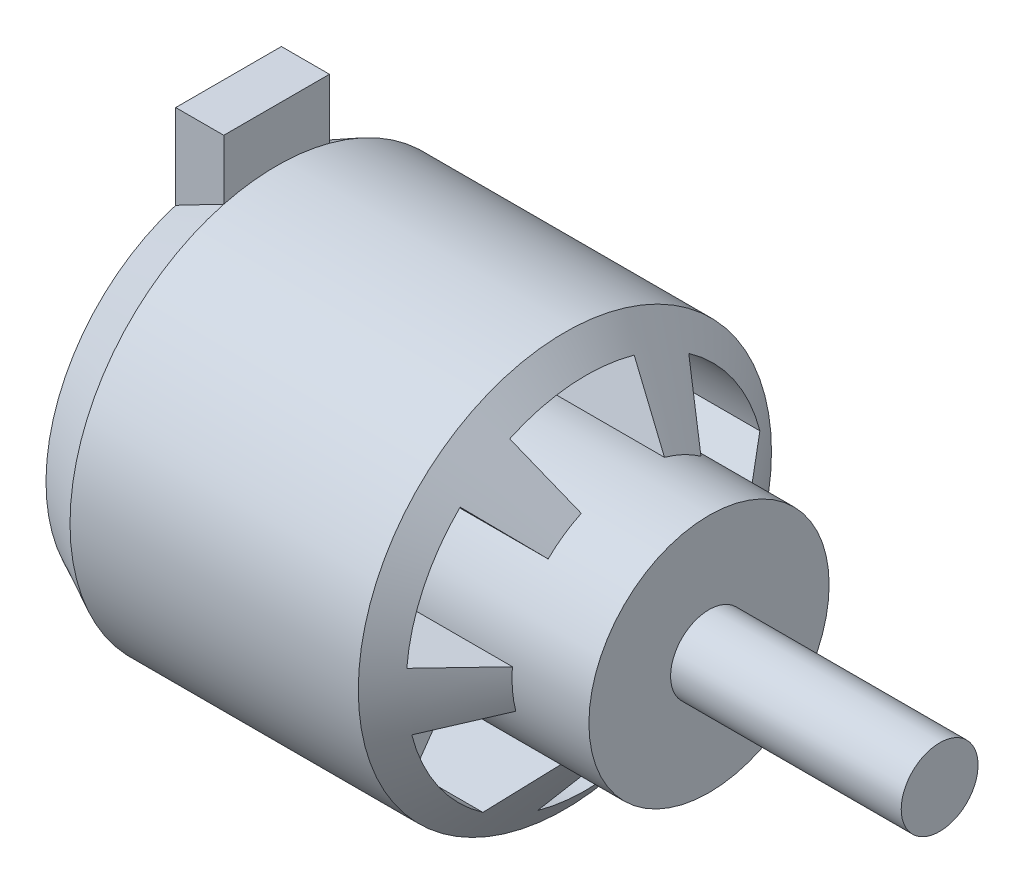
from build123d import *

# Parameters (mm, degrees)
CUT_EXTRUDE1_DEPTH  = 20
SKETCH3_W           = 5
SKETCH3_H           = 11
BOSS_EXTRUDE1_DEPTH = 27
SKETCH4_R           = 1.5
CUT_EXTRUDE2_DEPTH  = 5


with BuildPart() as part:
    # Sketch1 → Revolve1 (revolve)
    with BuildSketch(Plane.XY, mode=Mode.PRIVATE) as revolve1_sk:
        Polygon((0, 0), (0, 19), (5, 21.5), (35, 21.5), (42, 12.5), (50, 12.5), (50, 4), (74, 4), (74, 0), align=None)
    revolve(revolve1_sk.sketch.rotate(Axis((0, 0, 0), (1, 0, 0)), 90), axis=Axis((0, 0, 0), (1, 0, 0)))

    # Sketch2 → Cut-Extrude1 (cut)
    with BuildSketch(Plane(origin=(50, 0, 0), x_dir=(0, 0, -1), z_dir=(1, 0, 0))):
        with BuildLine():
            Line((18.630423, -1.611622), (12.453492, -1.077288))
            ThreePointArc((12.453492, -1.077288), (11.3025, -5.338867), (8.741979, -8.93464))
            Line((8.741979, -8.93464), (13.078001, -13.366222))
            ThreePointArc((13.078001, -13.366222), (16.908539, -7.986946), (18.630423, -1.611622))
        make_face()
        with BuildLine():
            Line((7.919506, -16.940231), (5.293787, -11.323684))
            ThreePointArc((5.293787, -11.323684), (1.027655, -12.457685), (-3.366636, -12.038096))
            Line((-3.366636, -12.038096), (-5.036487, -18.008992))
            ThreePointArc((-5.036487, -18.008992), (1.537372, -18.636697), (7.919506, -16.940231))
        make_face()
        with BuildLine():
            Line((-10.710917, -15.328609), (-7.159704, -10.246396))
            ThreePointArc((-7.159704, -10.246396), (-10.274845, -7.118818), (-12.108615, -3.103456))
            Line((-12.108615, -3.103456), (-18.114488, -4.64277))
            ThreePointArc((-18.114488, -4.64277), (-15.371167, -10.649752), (-10.710917, -15.328609))
        make_face()
        with BuildLine():
            Line((-18.630423, 1.611622), (-12.453492, 1.077288))
            ThreePointArc((-12.453492, 1.077288), (-11.3025, 5.338867), (-8.741979, 8.93464))
            Line((-8.741979, 8.93464), (-13.078001, 13.366222))
            ThreePointArc((-13.078001, 13.366222), (-16.908539, 7.986946), (-18.630423, 1.611622))
        make_face()
        with BuildLine():
            Line((-7.919506, 16.940231), (-5.293787, 11.323684))
            ThreePointArc((-5.293787, 11.323684), (-1.027655, 12.457685), (3.366636, 12.038096))
            Line((3.366636, 12.038096), (5.036487, 18.008992))
            ThreePointArc((5.036487, 18.008992), (-1.537372, 18.636697), (-7.919506, 16.940231))
        make_face()
        with BuildLine():
            Line((10.710917, 15.328609), (7.159704, 10.246396))
            ThreePointArc((7.159704, 10.246396), (10.274845, 7.118818), (12.108615, 3.103456))
            Line((12.108615, 3.103456), (18.114488, 4.64277))
            ThreePointArc((18.114488, 4.64277), (15.371167, 10.649752), (10.710917, 15.328609))
        make_face()
    extrude(amount=-CUT_EXTRUDE1_DEPTH, mode=Mode.SUBTRACT)

    # Sketch3 → Boss-Extrude1 (add)
    with BuildSketch(Plane(origin=(0, 0, 0), x_dir=(1, 0, 0), z_dir=(0, 1, 0))):
        with Locations((2.5, 0)):
            Rectangle(SKETCH3_W, SKETCH3_H)
    extrude(amount=BOSS_EXTRUDE1_DEPTH)

    # Sketch4 → Cut-Extrude2 (cut)
    with BuildSketch(Plane.ZY):
        with Locations((0, 12.35)):
            Circle(SKETCH4_R)
        with Locations((12.35, 0)):
            Circle(SKETCH4_R)
        with Locations((0, -12.35)):
            Circle(SKETCH4_R)
        with Locations((-12.35, 0)):
            Circle(SKETCH4_R)
    extrude(amount=-CUT_EXTRUDE2_DEPTH, mode=Mode.SUBTRACT)


solid = part.part
